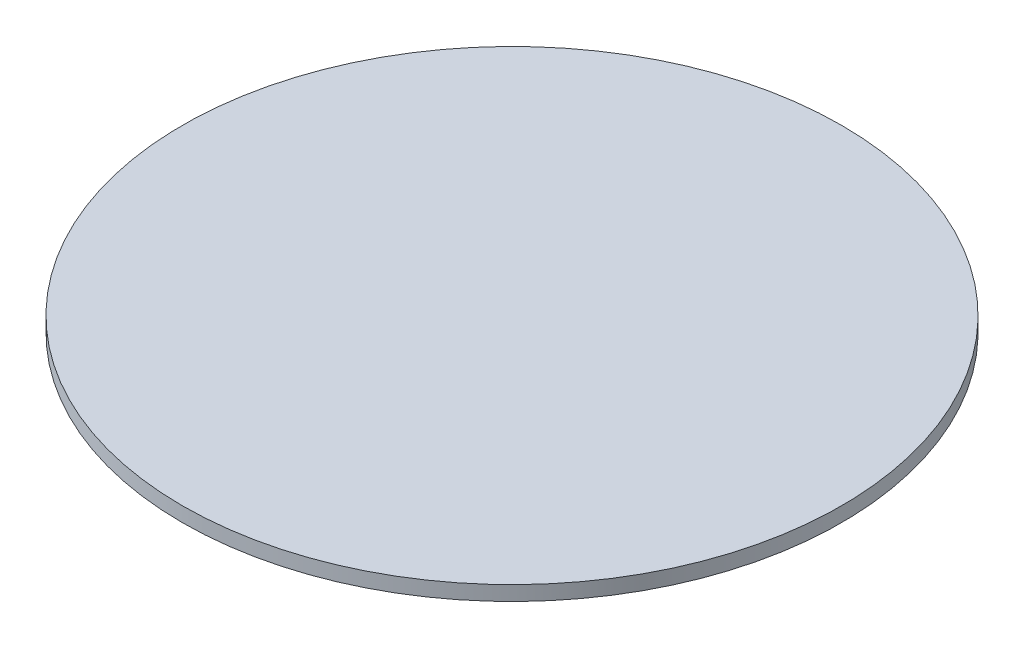
from build123d import *

# Parameters (mm, degrees)
SKETCH_1_R      = 90
EXTRUDE_1_DEPTH = 4


with BuildPart() as part:
    # 草圖1 → 填料-伸長1 (new body)
    with BuildSketch(Plane(origin=(0, 0, 0), x_dir=(1, 0, 0), z_dir=(0, 1, 0))):
        with Locations(Location((0, 0, 0), (0, 0, 270))):
            Circle(SKETCH_1_R)
    extrude(amount=EXTRUDE_1_DEPTH)


solid = part.part
